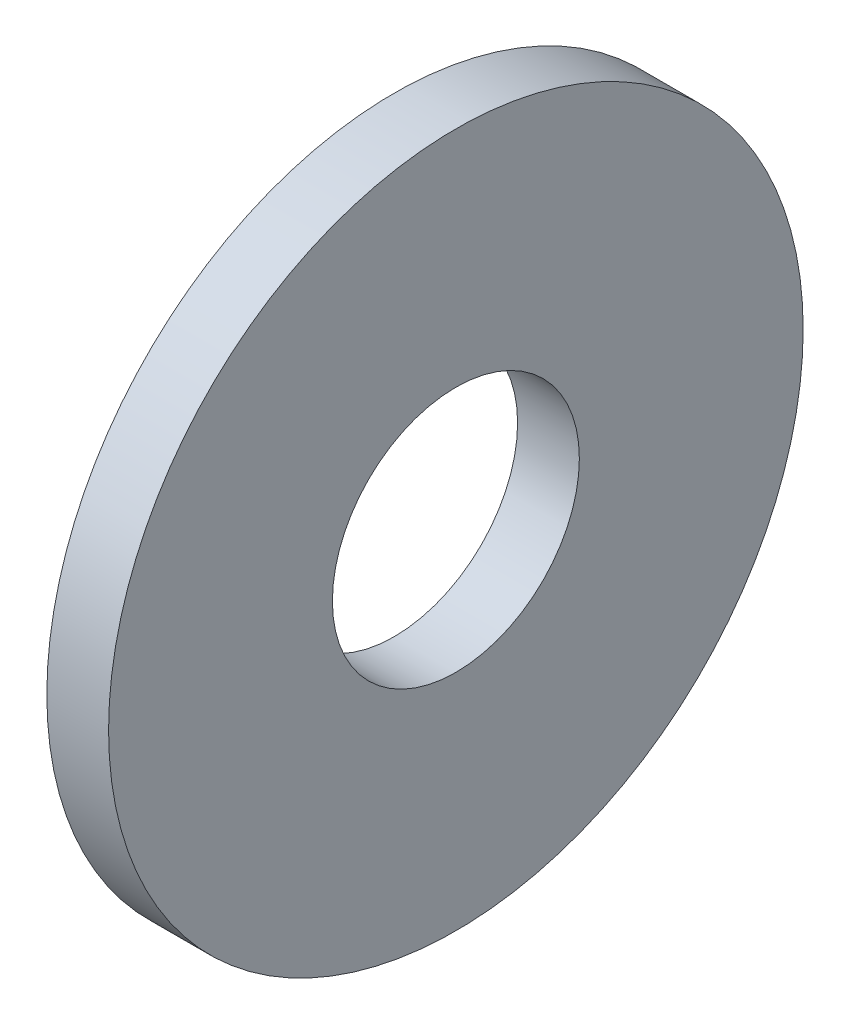
from build123d import *

# Parameters (mm, degrees)
SKETCH_WASHER_PROFILE_W = 1.6
SKETCH_WASHER_PROFILE_H = 5.8


with BuildPart() as part:
    # Sketch_Washer_Profile → Washer_Revolve_ID6p4_OD18_T1p6 (revolve)
    with BuildSketch(Plane.XY):
        with Locations((0.8, 6.1)):
            Rectangle(SKETCH_WASHER_PROFILE_W, SKETCH_WASHER_PROFILE_H)
    revolve(axis=Axis((-5, 0, 0), (1, 0, 0)))


solid = part.part
